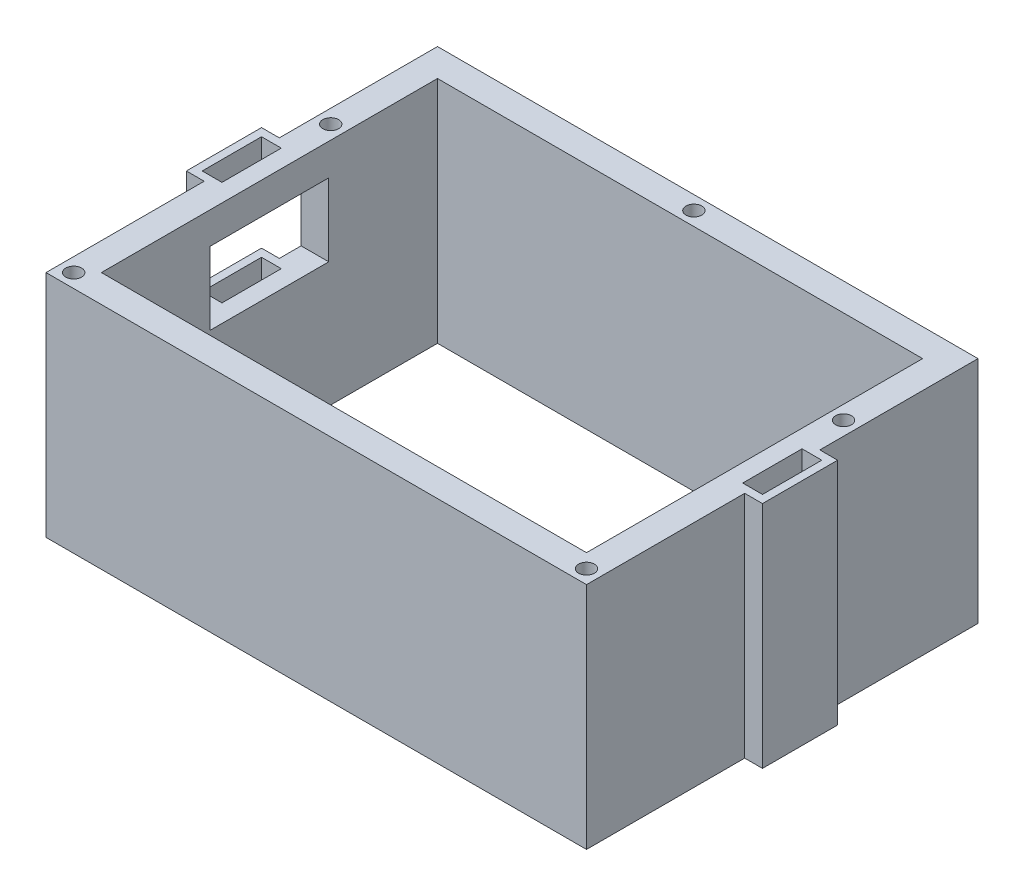
from build123d import *

# Parameters (mm, degrees)
SKETCH1_W               = 122.684034766
SKETCH1_H               = 85
BOSS_EXTRUDE1_DEPTH     = 58
SKETCH2_W               = 30
SKETCH2_H               = 18.398042608
CUT_EXTRUDE1_DEPTH      = 11.5
CUT_EXTRUDE3_DEPTH      = 5.7
CUT_EXTRUDE3_DEPTH_BACK = 0.0001
SKETCH3_R               = 2
CUT_EXTRUDE4_START      = -5.7
SKETCH5_R               = 2
CUT_EXTRUDE4_DEPTH      = 5.7


with BuildPart() as part:
    # Sketch1 → Boss-Extrude1 (new body)
    # profile 1 of 5: a face of its own
    with BuildSketch(Plane(origin=(0, 0, 0), x_dir=(1, 0, 0), z_dir=(0, 1, 0))):
        Polygon((-68.342017383, -9.5), (-68.342017383, -49.5), (68.342017383, -49.5), (68.342017383, -9.5), (63.842017383, -9.5), (63.842017383, 9.5), (68.342017383, 9.5), (68.342017383, 49.5), (-68.342017383, 49.5), (-68.342017383, 9.5), (-63.842017383, 9.5), (-63.842017383, -9.5), align=None)
        Rectangle(SKETCH1_W, SKETCH1_H, mode=Mode.SUBTRACT)
    # profile 2 of 5: a face of its own
    with BuildSketch(Plane(origin=(0, 0, 0), x_dir=(1, 0, 0), z_dir=(0, 1, 0))):
        Polygon((63.842017383, -9.5), (68.342017383, -9.5), (68.342017383, -7.5), (65.842017383, -7.5), (65.842017383, 7.5), (68.342017383, 7.5), (68.342017383, 9.5), (63.842017383, 9.5), align=None)
    # profile 3 of 5: a face of its own
    with BuildSketch(Plane(origin=(0, 0, 0), x_dir=(1, 0, 0), z_dir=(0, 1, 0))):
        Polygon((68.342017383, -7.5), (68.342017383, -9.5), (72.842017383, -9.5), (72.842017383, 9.5), (68.342017383, 9.5), (68.342017383, 7.5), (70.842017383, 7.5), (70.842017383, -7.5), align=None)
    # profile 4 of 5: a face of its own
    with BuildSketch(Plane(origin=(0, 0, 0), x_dir=(1, 0, 0), z_dir=(0, 1, 0))):
        Polygon((-72.842017383, -9.5), (-68.342017383, -9.5), (-68.342017383, -7.5), (-70.842017383, -7.5), (-70.842017383, 7.5), (-68.342017383, 7.5), (-68.342017383, 9.5), (-72.842017383, 9.5), align=None)
    # profile 5 of 5: a face of its own
    with BuildSketch(Plane(origin=(0, 0, 0), x_dir=(1, 0, 0), z_dir=(0, 1, 0))):
        Polygon((-68.342017383, -7.5), (-68.342017383, -9.5), (-63.842017383, -9.5), (-63.842017383, 9.5), (-68.342017383, 9.5), (-68.342017383, 7.5), (-65.842017383, 7.5), (-65.842017383, -7.5), align=None)
    extrude(amount=BOSS_EXTRUDE1_DEPTH)

    # Sketch2 → Cut-Extrude1 (cut)
    with BuildSketch(Plane.ZY.offset(72.842017383)):
        with Locations((0, 40.800978696)):
            Rectangle(SKETCH2_W, SKETCH2_H)
    extrude(amount=-CUT_EXTRUDE1_DEPTH, mode=Mode.SUBTRACT)

    # Sketch3 → Cut-Extrude3 (cut, two sides: drawn at the far end of the back side and taken through both)
    with BuildSketch(Plane(origin=(0, 0, 0), x_dir=(1, 0, 0), z_dir=(0, 1, 0)).offset(-CUT_EXTRUDE3_DEPTH_BACK)):
        with Locations(Location((64.842017383, -46, 0), (0, 0, 270))):
            Circle(SKETCH3_R)
        with Locations(Location((64.842017383, 46, 0), (0, 0, 90))):
            Circle(SKETCH3_R)
        with Locations(Location((-64.842017383, 46, 0), (0, 0, 270))):
            Circle(SKETCH3_R)
        with Locations(Location((-64.842017383, -46, 0), (0, 0, 90))):
            Circle(SKETCH3_R)
    extrude(amount=CUT_EXTRUDE3_DEPTH + CUT_EXTRUDE3_DEPTH_BACK, mode=Mode.SUBTRACT)

    # Sketch5 → Cut-Extrude4 (cut)
    with BuildSketch(Plane(origin=(0, 58, 0), x_dir=(1, 0, 0), z_dir=(0, 1, 0)).offset(CUT_EXTRUDE4_START)):
        with Locations(Location((-64.842017383, -46, 0), (0, 0, 90))):
            Circle(SKETCH5_R)
        with Locations(Location((64.842017383, -46, 0), (0, 0, 270))):
            Circle(SKETCH5_R)
        with Locations(Location((64.842017383, 19, 0), (0, 0, 270))):
            Circle(SKETCH5_R)
        with Locations(Location((-64.842017383, 19, 0), (0, 0, 90))):
            Circle(SKETCH5_R)
        with Locations(Location((0, 46, 0), (0, 0, 270))):
            Circle(SKETCH5_R)
    extrude(amount=CUT_EXTRUDE4_DEPTH, mode=Mode.SUBTRACT)


solid = part.part
